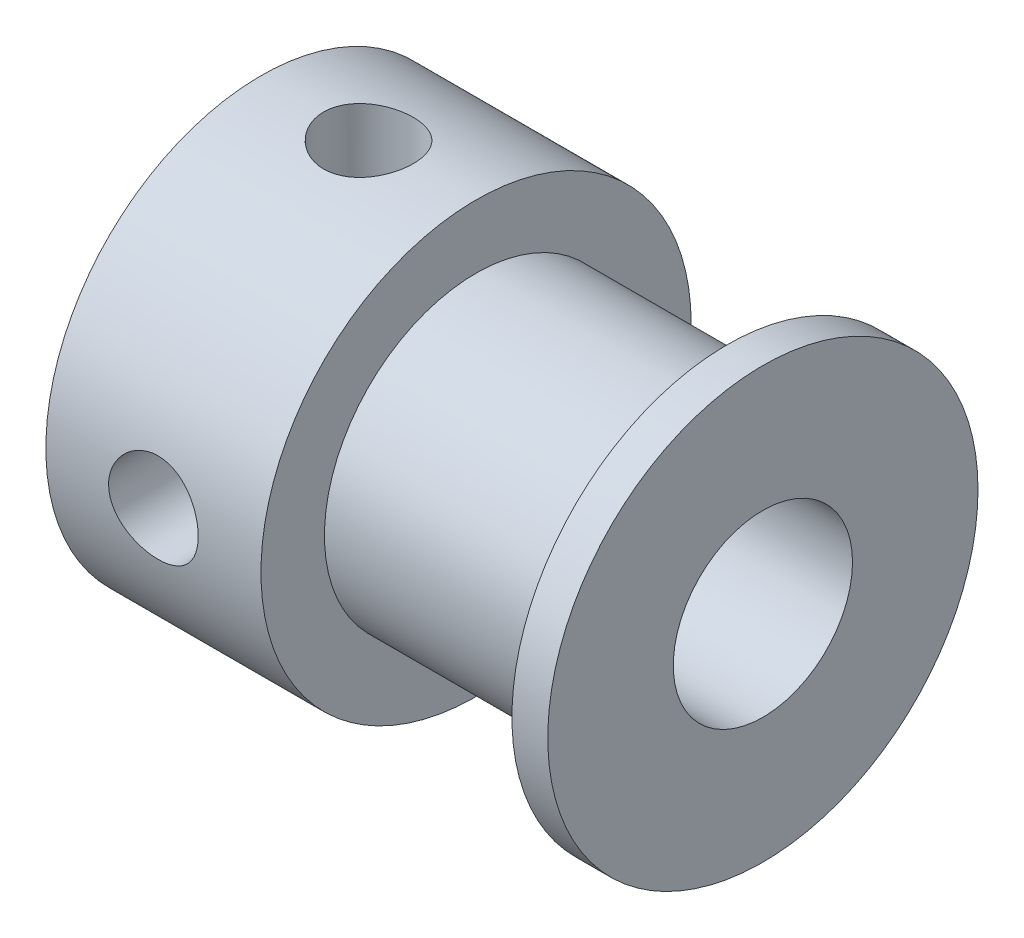
from build123d import *

# Parameters (mm, degrees)
SKETCH2_W = 1.25
SKETCH2_H = 6
SKETCH4_W = 1.25
SKETCH4_H = 6


with BuildPart() as part:
    # Sketch1 → Revolve1 (revolve)
    with BuildSketch(Plane.XY, mode=Mode.PRIVATE) as revolve1_sk:
        Polygon((0, 2.5), (0, 6), (6, 6), (6, 4.2291), (13, 4.2291), (13, 6), (14, 6), (14, 2.5), align=None)
    revolve(revolve1_sk.sketch.rotate(Axis((0, 0, 0), (-1, 0, 0)), 90), axis=Axis((0, 0, 0), (-1, 0, 0)))

    # Sketch2 → M3x0.5 Tapped Hole1 (revolve, cut)
    with BuildSketch(Plane(origin=(3, 0, 0), x_dir=(0, 0, -1), z_dir=(1, 0, 0))):
        with Locations((0.625, 3)):
            Rectangle(SKETCH2_W, SKETCH2_H)
    revolve(axis=Axis((3, -6.35, 0), (0, 1, 0)), mode=Mode.SUBTRACT)

    # Sketch4 → M3x0.5 Tapped Hole2 (revolve, cut)
    with BuildSketch(Plane.YZ.offset(3)):
        with Locations((0.625, 3)):
            Rectangle(SKETCH4_W, SKETCH4_H)
    revolve(axis=Axis((3, 0, -6.35), (0, 0, 1)), mode=Mode.SUBTRACT)


solid = part.part
